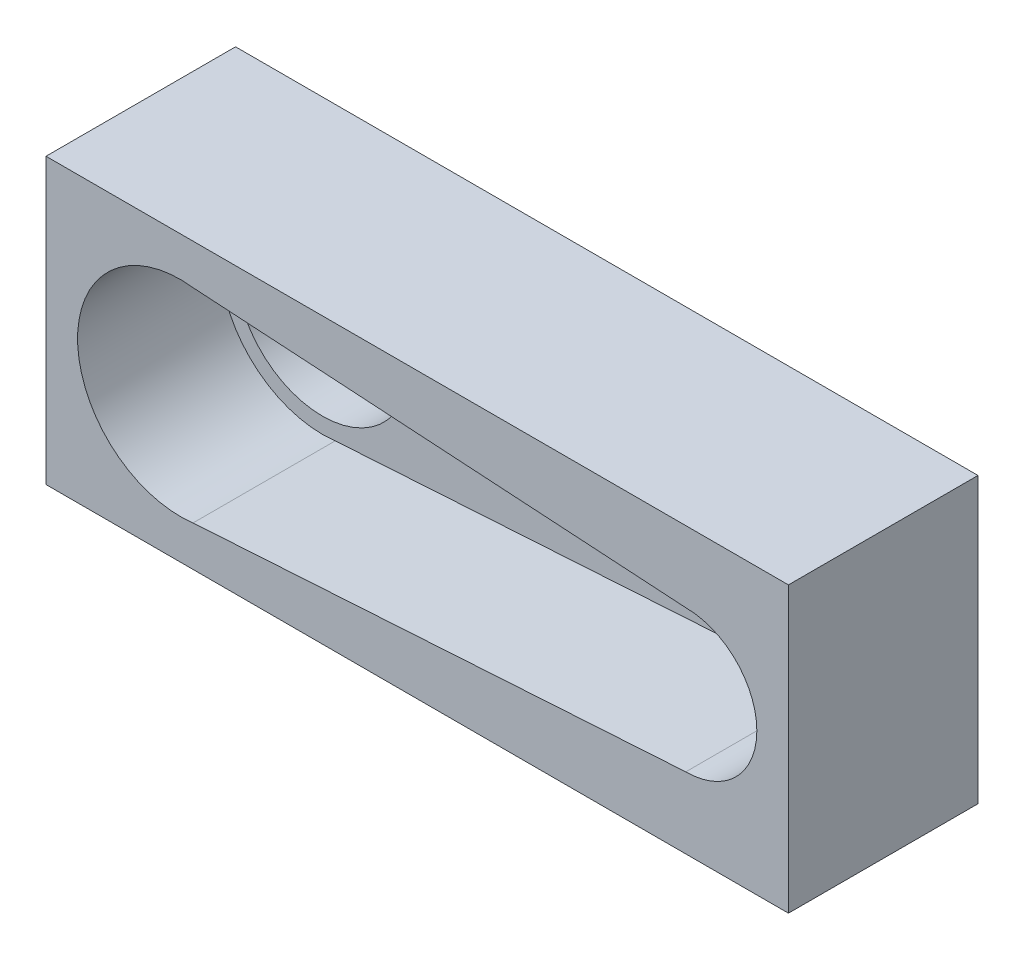
from build123d import *

# Parameters (mm, degrees)
BOSS_EXTRU_1_DEPTH = 9
BOSS_EXTRU_2_START = -3
ESQUISSE2_W        = 47
ESQUISSE2_H        = 18
ESQUISSE2_R        = 0.75
ESQUISSE2_R_2      = 5.5
BOSS_EXTRU_2_DEPTH = 3


with BuildPart() as part:
    # Esquisse1 → Boss.-Extru.1 (new body)
    with BuildSketch(Plane.XY):
        with BuildLine():
            Line((0, 18), (0, 9))
            Line((0, 9), (2, 9))
            ThreePointArc((2, 9), (3.903805922, 13.596194078), (8.5, 15.5))
            ThreePointArc((8.5, 15.5), (8.90545886, 15.48734176), (9.309338521, 15.449416342))
            Line((9.309338521, 15.449416342), (40.5, 13.5))
            ThreePointArc((40.5, 13.5), (43.681980515, 12.181980515), (45, 9))
            Line((45, 9), (47, 9))
            Line((47, 9), (47, 18))
            Line((47, 18), (0, 18))
        make_face()
        with BuildLine():
            Line((0, 9), (0, 0))
            Line((0, 0), (47, 0))
            Line((47, 0), (47, 9))
            Line((47, 9), (45, 9))
            ThreePointArc((45, 9), (43.681980515, 5.818019485), (40.5, 4.5))
            Line((40.5, 4.5), (9.309338521, 2.550583658))
            ThreePointArc((9.309338521, 2.550583658), (8.90545886, 2.51265824), (8.5, 2.5))
            ThreePointArc((8.5, 2.5), (3.903805922, 4.403805922), (2, 9))
            Line((2, 9), (0, 9))
        make_face()
    extrude(amount=BOSS_EXTRU_1_DEPTH)

    # Esquisse2 → Boss.-Extru.2 (add)
    with BuildSketch(Plane.XY.offset(BOSS_EXTRU_2_START)):
        with Locations((23.5, 9)):
            Rectangle(ESQUISSE2_W, ESQUISSE2_H)
        with BuildLine():
            Line((8.5, 2.5), (9.309338521, 2.550583658))
            ThreePointArc((9.309338521, 2.550583658), (8.90545886, 2.51265824), (8.5, 2.5))
        make_face(mode=Mode.SUBTRACT)
        with Locations((36.5, 9)):
            Circle(ESQUISSE2_R, mode=Mode.SUBTRACT)
        with Locations((31, 9)):
            Circle(ESQUISSE2_R, mode=Mode.SUBTRACT)
        with Locations((8.5, 9)):
            Circle(ESQUISSE2_R_2, mode=Mode.SUBTRACT)
        with BuildLine():
            Line((9.309338521, 15.449416342), (8.5, 15.5))
            ThreePointArc((8.5, 15.5), (8.90545886, 15.48734176), (9.309338521, 15.449416342))
        make_face(mode=Mode.SUBTRACT)
        with Locations((42, 9)):
            Circle(ESQUISSE2_R, mode=Mode.SUBTRACT)
    extrude(amount=BOSS_EXTRU_2_DEPTH)


solid = part.part
